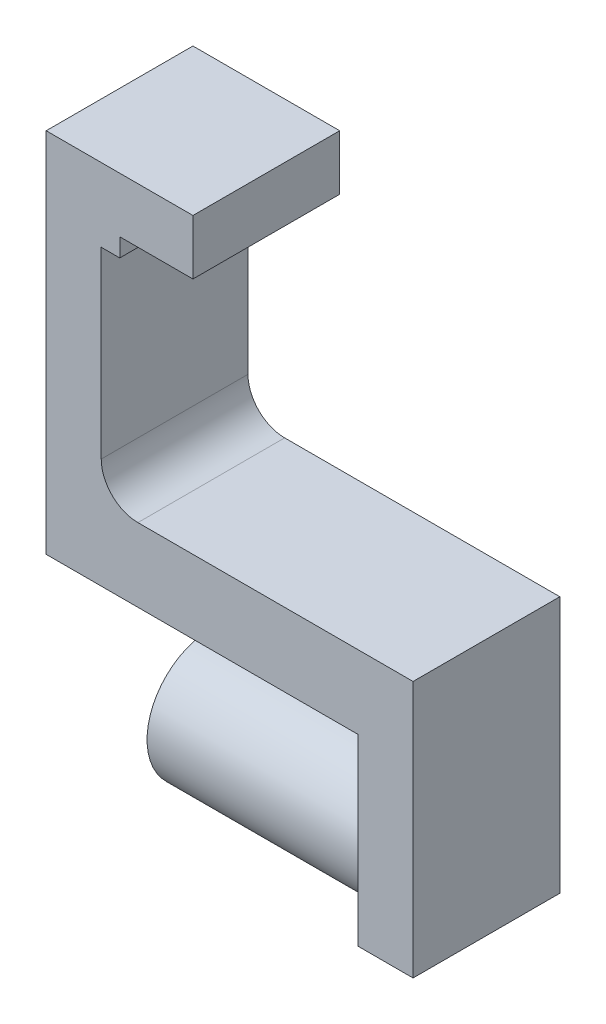
from build123d import *

# Parameters (mm, degrees)
SKETCH1_R                = 11.1125
BOSS_EXTRUDE1_DEPTH      = 38.1
BOSS_EXTRUDE2_DEPTH      = 12.7
BOSS_EXTRUDE2_DEPTH_BACK = 12.7
SKETCH2_W                = 9.525
SKETCH2_H                = 31.75
BOSS_EXTRUDE3_DEPTH      = 12.7
BOSS_EXTRUDE3_DEPTH_BACK = 12.7
SKETCH3_W                = 63.5
SKETCH3_H                = 12.7
BOSS_EXTRUDE4_DEPTH      = 12.7
BOSS_EXTRUDE4_DEPTH_BACK = 12.7
SKETCH4_W                = 9.525
SKETCH4_H                = 63.5
BOSS_EXTRUDE5_DEPTH      = 12.7
BOSS_EXTRUDE5_DEPTH_BACK = 12.7
FILLET1_R                = 6.35


with BuildPart() as part:
    # Sketch1 → Boss-Extrude1 (new body)
    with BuildSketch(Plane(origin=(0, 0, 0), x_dir=(0, 0, -1), z_dir=(1, 0, 0))):
        Circle(SKETCH1_R)
    extrude(amount=-BOSS_EXTRUDE1_DEPTH)

    # Sketch2 → Boss-Extrude2 (add, two sides: drawn at the far end of the back side and taken through both)
    with BuildSketch(Plane.XY.offset(-BOSS_EXTRUDE2_DEPTH_BACK)):
        with Locations((4.7625, 4.7625)):
            Rectangle(SKETCH2_W, SKETCH2_H)
    extrude(amount=BOSS_EXTRUDE2_DEPTH + BOSS_EXTRUDE2_DEPTH_BACK)

    # Sketch3 → Boss-Extrude3 (add, two sides: drawn at the far end of the back side and taken through both)
    with BuildSketch(Plane.XY.offset(-BOSS_EXTRUDE3_DEPTH_BACK)):
        with Locations((-22.225, 26.9875)):
            Rectangle(SKETCH3_W, SKETCH3_H)
    extrude(amount=BOSS_EXTRUDE3_DEPTH + BOSS_EXTRUDE3_DEPTH_BACK)

    # Sketch4 → Boss-Extrude4 (add, two sides: drawn at the far end of the back side and taken through both)
    with BuildSketch(Plane.XY.offset(-BOSS_EXTRUDE4_DEPTH_BACK)):
        with Locations((-49.2125, 52.3875)):
            Rectangle(SKETCH4_W, SKETCH4_H)
    extrude(amount=BOSS_EXTRUDE4_DEPTH + BOSS_EXTRUDE4_DEPTH_BACK)

    # Sketch5 → Boss-Extrude5 (add, two sides: drawn at the far end of the back side and taken through both)
    with BuildSketch(Plane.XY.offset(-BOSS_EXTRUDE5_DEPTH_BACK)):
        Polygon((-53.975, 71.4375), (-41.23944, 71.4375), (-41.23944, 74.6125), (-28.575, 74.6125), (-28.575, 84.1375), (-53.975, 84.1375), align=None)
    extrude(amount=BOSS_EXTRUDE5_DEPTH + BOSS_EXTRUDE5_DEPTH_BACK)

    # Fillet1
    fillet1_edges = [part.edges().sort_by_distance(p)[0] for p in [
        (-44.45, 33.3375, 0),
    ]]
    fillet(fillet1_edges, radius=FILLET1_R)


solid = part.part
